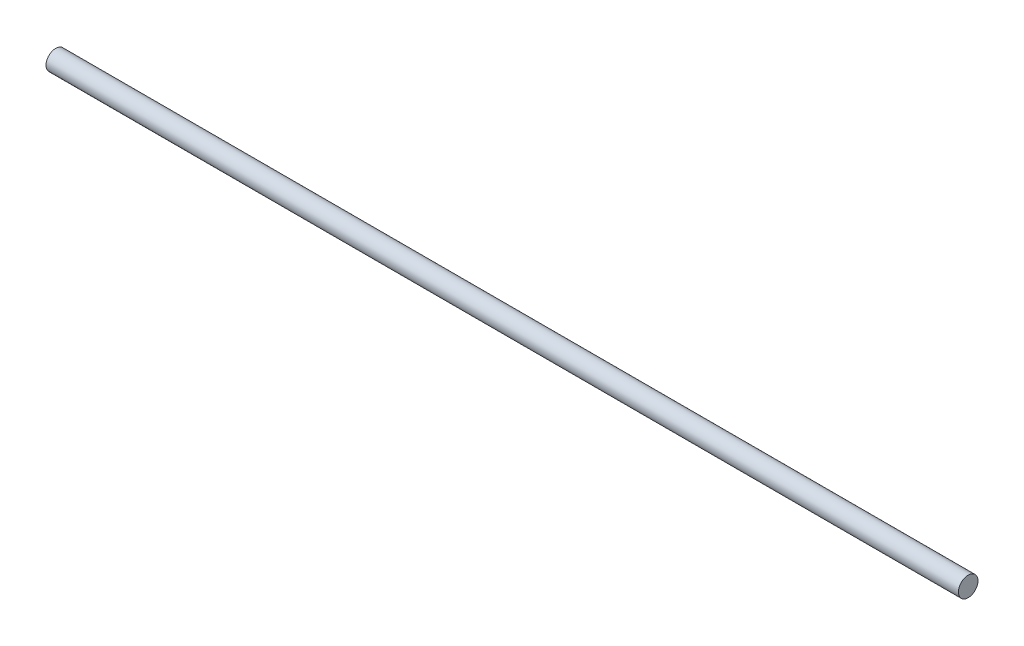
from build123d import *

# Parameters (mm, degrees)
SKETCH1_R           = 4
BOSS_EXTRUDE1_DEPTH = 373


with BuildPart() as part:
    # Sketch1 → Boss-Extrude1 (new body)
    with BuildSketch(Plane(origin=(0, 0, 0), x_dir=(0, 0, -1), z_dir=(1, 0, 0))):
        Circle(SKETCH1_R)
    extrude(amount=BOSS_EXTRUDE1_DEPTH)


solid = part.part
